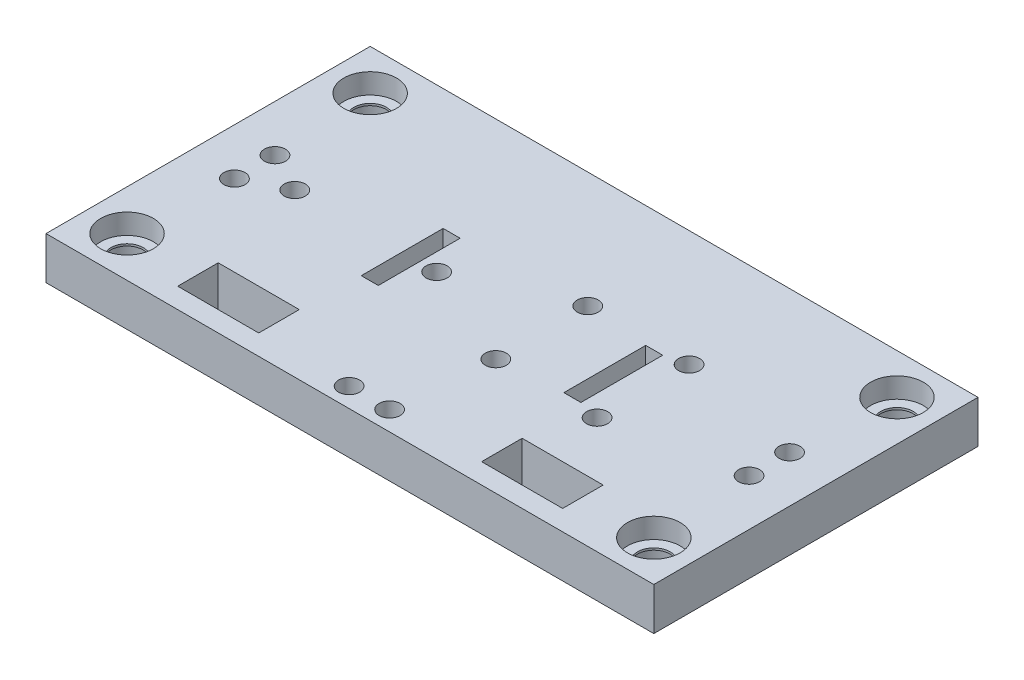
from build123d import *

# Parameters (mm, degrees)
SKETCH1_W            = 150
SKETCH1_H            = 80
BOSS_EXTRUDE1_DEPTH  = 10.5
SKETCH10_R           = 6.5
CUT_EXTRUDE8_DEPTH   = 5
WIREHOLES_REACH      = 172.324
SKETCH3_W            = 20
SKETCH3_H            = 10
SKETCH6_R            = 2.6
F_4AACUT_DEPTH       = 5.2
SKETCH7_R            = 2.6
F_2AACUT_DEPTH       = 5.2
SKETCH5_W            = 4.2
SKETCH5_H            = 20.2
ARDUINOMEGACUT_DEPTH = 5.2
SKETCH8_R            = 2.6
MPUCUT_DEPTH         = 5.2
CUT_EXTRUDE7_REACH   = 172.324
SKETCH9_R            = 2.6
SKETCH11_R           = 4
CUT_EXTRUDE9_DEPTH   = 0.5


with BuildPart() as part:
    # Sketch1 → Boss-Extrude1 (new body)
    with BuildSketch(Plane(origin=(0, 0, 0), x_dir=(1, 0, 0), z_dir=(0, 1, 0))):
        with Locations((75, 40)):
            Rectangle(SKETCH1_W, SKETCH1_H)
    extrude(amount=BOSS_EXTRUDE1_DEPTH)

    # Sketch10 → Cut-Extrude8 (cut)
    with BuildSketch(Plane(origin=(0, 10.5, 0), x_dir=(1, 0, 0), z_dir=(0, 1, 0))):
        with Locations(Location((10, 10, 0), (0, 0, 270))):
            Circle(SKETCH10_R)
        with Locations(Location((140, 10, 0), (0, 0, 270))):
            Circle(SKETCH10_R)
        with Locations(Location((10, 70, 0), (0, 0, 270))):
            Circle(SKETCH10_R)
        with Locations(Location((140, 70, 0), (0, 0, 270))):
            Circle(SKETCH10_R)
    cut_extrude8 = extrude(amount=-CUT_EXTRUDE8_DEPTH, mode=Mode.SUBTRACT)

    # Mirror1: Cut-Extrude8 across plane
    add(cut_extrude8.mirror(Plane.ZX.offset(5.25)), mode=Mode.SUBTRACT)

    # Sketch3 → WireHoles (cut, up to next)
    with BuildSketch(Plane(origin=(0, 10.5, 0), x_dir=(1, 0, 0), z_dir=(0, 1, 0)), mode=Mode.PRIVATE) as wireholes_sk1:
        with Locations((37.5, 10)):
            Rectangle(SKETCH3_W, SKETCH3_H)
    wireholes_tool1 = extrude(wireholes_sk1.sketch, amount=-WIREHOLES_REACH, mode=Mode.PRIVATE) & part.part
    # Sketch3 → WireHoles (cut, up to next)
    with BuildSketch(Plane(origin=(0, 10.5, 0), x_dir=(1, 0, 0), z_dir=(0, 1, 0)), mode=Mode.PRIVATE) as wireholes_sk2:
        with Locations((112.5, 10)):
            Rectangle(SKETCH3_W, SKETCH3_H)
    wireholes_tool2 = extrude(wireholes_sk2.sketch, amount=-WIREHOLES_REACH, mode=Mode.PRIVATE) & part.part
    add(wireholes_tool1.solids().sort_by_distance((37.5, 10.5, -10))[0], mode=Mode.SUBTRACT)
    add(wireholes_tool2.solids().sort_by_distance((112.5, 10.5, -10))[0], mode=Mode.SUBTRACT)

    # Sketch6 → 4AACut (cut)
    with BuildSketch(Plane(origin=(0, 10.5, 0), x_dir=(1, 0, 0), z_dir=(0, 1, 0))):
        with Locations(Location((21.4, 40, 0), (0, 0, 270))):
            Circle(SKETCH6_R)
        with Locations(Location((56.4, 40, 0), (0, 0, 90))):
            Circle(SKETCH6_R)
    extrude(amount=-F_4AACUT_DEPTH, mode=Mode.SUBTRACT)

    # Sketch7 → 2AACut (cut)
    with BuildSketch(Plane(origin=(0, 10.5, 0), x_dir=(1, 0, 0), z_dir=(0, 1, 0))):
        with Locations(Location((82.35, 51.35, 0), (0, 0, 270))):
            Circle(SKETCH7_R)
        with Locations(Location((107.35, 51.35, 0), (0, 0, 90))):
            Circle(SKETCH7_R)
        with Locations(Location((82.35, 28.65, 0), (0, 0, 90))):
            Circle(SKETCH7_R)
        with Locations(Location((107.35, 28.65, 0), (0, 0, 270))):
            Circle(SKETCH7_R)
    extrude(amount=-F_2AACUT_DEPTH, mode=Mode.SUBTRACT)

    # Sketch5 → ArduinoMegaCut (cut)
    with BuildSketch(Plane(origin=(0, 10.5, 0), x_dir=(1, 0, 0), z_dir=(0, 1, 0))):
        with Locations((50, 40)):
            Rectangle(SKETCH5_W, SKETCH5_H)
        with Locations((100, 40)):
            Rectangle(SKETCH5_W, SKETCH5_H)
    extrude(amount=-ARDUINOMEGACUT_DEPTH, mode=Mode.SUBTRACT)

    # Sketch8 → MPUCut (cut)
    with BuildSketch(Plane(origin=(0, 10.5, 0), x_dir=(1, 0, 0), z_dir=(0, 1, 0))):
        with Locations(Location((70, 4.8, 0), (0, 0, 270))):
            Circle(SKETCH8_R)
        with Locations(Location((80, 4.8, 0), (0, 0, 90))):
            Circle(SKETCH8_R)
    extrude(amount=-MPUCUT_DEPTH, mode=Mode.SUBTRACT)

    # Sketch9 → Cut-Extrude7 (cut, up to next)
    with BuildSketch(Plane(origin=(0, 10.5, 0), x_dir=(1, 0, 0), z_dir=(0, 1, 0)), mode=Mode.PRIVATE) as cut_extrude7_sk1:
        with Locations(Location((138.5, 45, 0), (0, 0, 270))):
            Circle(SKETCH9_R)
    cut_extrude7_tool1 = extrude(cut_extrude7_sk1.sketch, amount=-CUT_EXTRUDE7_REACH, mode=Mode.PRIVATE) & part.part
    # Sketch9 → Cut-Extrude7 (cut, up to next)
    with BuildSketch(Plane(origin=(0, 10.5, 0), x_dir=(1, 0, 0), z_dir=(0, 1, 0)), mode=Mode.PRIVATE) as cut_extrude7_sk2:
        with Locations(Location((138.5, 35, 0), (0, 0, 270))):
            Circle(SKETCH9_R)
    cut_extrude7_tool2 = extrude(cut_extrude7_sk2.sketch, amount=-CUT_EXTRUDE7_REACH, mode=Mode.PRIVATE) & part.part
    # Sketch9 → Cut-Extrude7 (cut, up to next)
    with BuildSketch(Plane(origin=(0, 10.5, 0), x_dir=(1, 0, 0), z_dir=(0, 1, 0)), mode=Mode.PRIVATE) as cut_extrude7_sk3:
        with Locations(Location((11.5, 45, 0), (0, 0, 270))):
            Circle(SKETCH9_R)
    cut_extrude7_tool3 = extrude(cut_extrude7_sk3.sketch, amount=-CUT_EXTRUDE7_REACH, mode=Mode.PRIVATE) & part.part
    # Sketch9 → Cut-Extrude7 (cut, up to next)
    with BuildSketch(Plane(origin=(0, 10.5, 0), x_dir=(1, 0, 0), z_dir=(0, 1, 0)), mode=Mode.PRIVATE) as cut_extrude7_sk4:
        with Locations(Location((11.5, 35, 0), (0, 0, 270))):
            Circle(SKETCH9_R)
    cut_extrude7_tool4 = extrude(cut_extrude7_sk4.sketch, amount=-CUT_EXTRUDE7_REACH, mode=Mode.PRIVATE) & part.part
    add(cut_extrude7_tool1.solids().sort_by_distance((138.5, 10.5, -45))[0], mode=Mode.SUBTRACT)
    add(cut_extrude7_tool2.solids().sort_by_distance((138.5, 10.5, -35))[0], mode=Mode.SUBTRACT)
    add(cut_extrude7_tool3.solids().sort_by_distance((11.5, 10.5, -45))[0], mode=Mode.SUBTRACT)
    add(cut_extrude7_tool4.solids().sort_by_distance((11.5, 10.5, -35))[0], mode=Mode.SUBTRACT)

    # Sketch11 → Cut-Extrude9 (cut)
    with BuildSketch(Plane(origin=(0, 5.5, 0), x_dir=(1, 0, 0), z_dir=(0, 1, 0))):
        with Locations(Location((10, 10, 0), (0, 0, 270))):
            Circle(SKETCH11_R)
        with Locations(Location((10, 70, 0), (0, 0, 90))):
            Circle(SKETCH11_R)
        with Locations(Location((140, 70, 0), (0, 0, 270))):
            Circle(SKETCH11_R)
        with Locations(Location((140, 10, 0), (0, 0, 90))):
            Circle(SKETCH11_R)
    extrude(amount=-CUT_EXTRUDE9_DEPTH, mode=Mode.SUBTRACT)


solid = part.part
